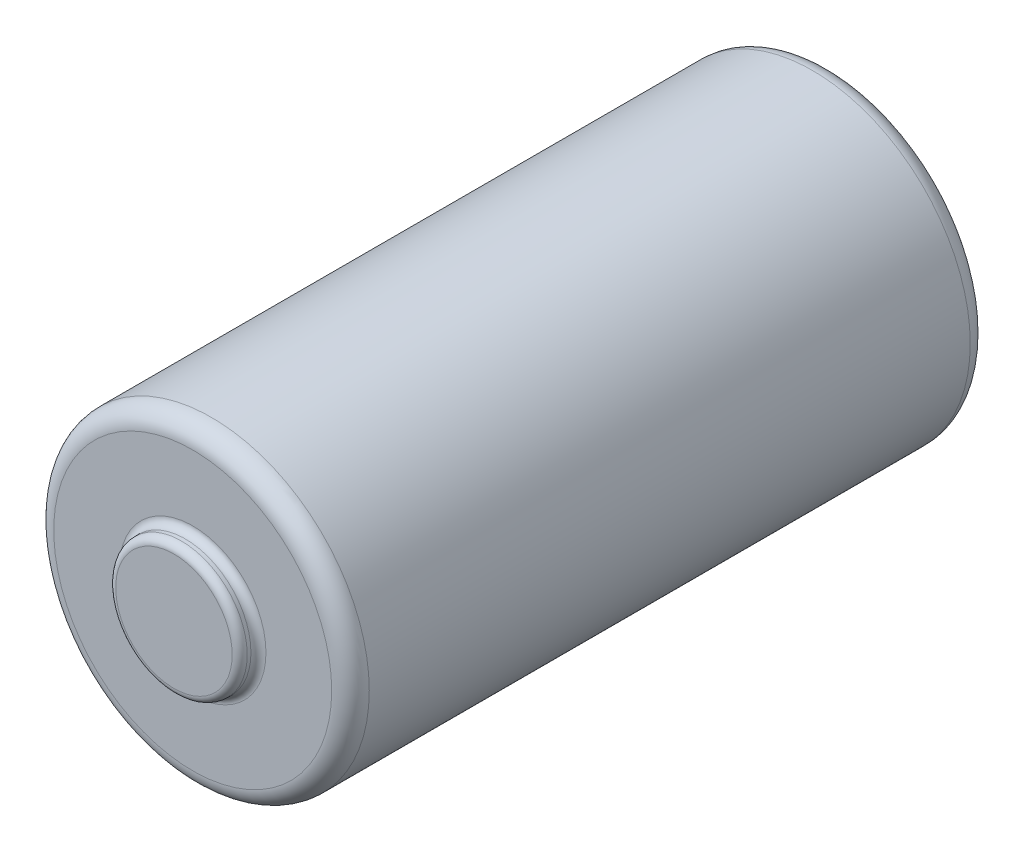
from build123d import *

# Parameters (mm, degrees)
SKETCH1_R           = 8.4
BOSS_EXTRUDE1_DEPTH = 34
SKETCH2_R           = 3.5
BOSS_EXTRUDE2_DEPTH = 1
FILLET1_R           = 1
FILLET2_R           = 0.4


with BuildPart() as part:
    # Sketch1 → Boss-Extrude1 (new body)
    with BuildSketch(Plane.XY):
        Circle(SKETCH1_R)
    extrude(amount=BOSS_EXTRUDE1_DEPTH)

    # Sketch2 → Boss-Extrude2 (add)
    with BuildSketch(Plane.XY.offset(34)):
        Circle(SKETCH2_R)
    extrude(amount=BOSS_EXTRUDE2_DEPTH)

    # Fillet1
    fillet1_edges = [part.edges().sort_by_distance(p)[0] for p in [
        (-8.4, 0, 0),
        (-8.4, 0, 34),
    ]]
    fillet(fillet1_edges, radius=FILLET1_R)

    # Fillet2
    fillet2_edges = [part.edges().sort_by_distance(p)[0] for p in [
        (-3.5, 0, 34),
        (-3.5, 0, 35),
    ]]
    fillet(fillet2_edges, radius=FILLET2_R)


solid = part.part
